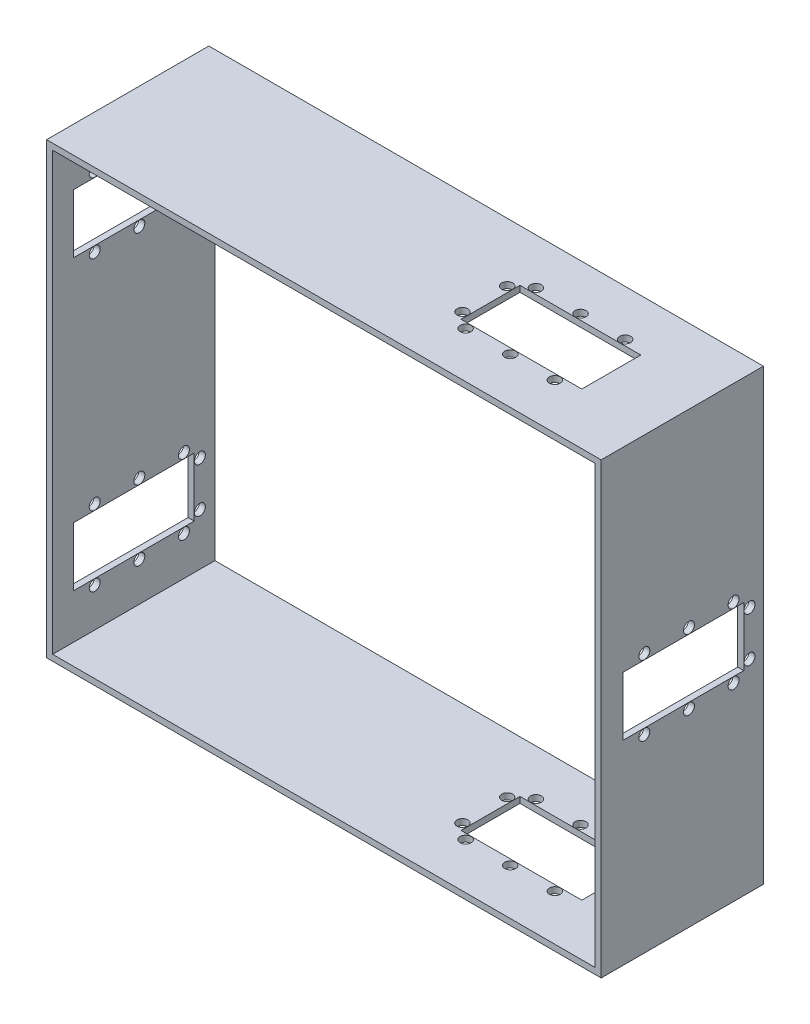
from build123d import *

# Parameters (mm, degrees)
ESBO_O2_W                  = 273.42
ESBO_O2_H                  = 221.24
RESSALTO_EXTRUS_O1_DEPTH   = 80
ESBO_O3_W                  = 267.42
ESBO_O3_H                  = 215.24
CORTE_EXTRUS_O1_DEPTH      = 80
ESBO_O4_W                  = 59.55
ESBO_O4_H                  = 29.05
CORTE_EXTRUS_O3_DEPTH      = 194.200436076
ESBO_O5_W                  = 59.55
ESBO_O5_H                  = 29.05
CORTE_EXTRUS_O4_DEPTH      = 194.200436076
CORTE_EXTRUS_O5_DEPTH      = 194.200436076
CORTE_EXTRUS_O5_DEPTH_BACK = 194.200436076
ESBO_O6_W                  = 59.55
ESBO_O6_H                  = 29.05
CORTE_EXTRUS_O6_DEPTH      = 194.200436076
CORTE_EXTRUS_O6_DEPTH_BACK = 194.200436076
ESBO_O7_R                  = 2.7
ESBO_O8_R                  = 2.7
CORTE_EXTRUS_O7_DEPTH      = 194.200436076
ESBO_O9_R                  = 2.7
CORTE_EXTRUS_O8_DEPTH      = 194.200436076


with BuildPart() as part:
    # Esboço2 → Ressalto-extrusão1 (new body)
    with BuildSketch(Plane.XY):
        Rectangle(ESBO_O2_W, ESBO_O2_H)
    extrude(amount=RESSALTO_EXTRUS_O1_DEPTH)

    # Esboço3 → Corte-extrusão1 (cut)
    with BuildSketch(Plane.XY):
        Rectangle(ESBO_O3_W, ESBO_O3_H)
    extrude(amount=CORTE_EXTRUS_O1_DEPTH, mode=Mode.SUBTRACT)

    # Esboço4 → Corte-extrusão3 (cut, through all)
    with BuildSketch(Plane(origin=(0, 0, 0), x_dir=(0, 0, -1), z_dir=(1, 0, 0))):
        with Locations((-39.439615286, 0)):
            Rectangle(ESBO_O4_W, ESBO_O4_H)
    extrude(amount=CORTE_EXTRUS_O3_DEPTH, mode=Mode.SUBTRACT)

    # Esboço5 → Corte-extrusão4 (cut, through all)
    with BuildSketch(Plane(origin=(0, 0, 0), x_dir=(0, 0, -1), z_dir=(1, 0, 0))):
        with Locations((-40, 71.095)):
            Rectangle(ESBO_O5_W, ESBO_O5_H)
        with Locations((-40, -71.095)):
            Rectangle(ESBO_O5_W, ESBO_O5_H)
    extrude(amount=-CORTE_EXTRUS_O4_DEPTH, mode=Mode.SUBTRACT)

    # Esboço6 → Corte-extrusão5 (cut, two sides: drawn at the far end of the back side and taken through both)
    with BuildSketch(Plane(origin=(0, 0, 0), x_dir=(1, 0, 0), z_dir=(0, 1, 0)).offset(-CORTE_EXTRUS_O5_DEPTH_BACK)):
        with Locations((71.935, -40)):
            Rectangle(ESBO_O6_W, ESBO_O6_H)
    extrude(amount=CORTE_EXTRUS_O5_DEPTH + CORTE_EXTRUS_O5_DEPTH_BACK, mode=Mode.SUBTRACT)

    # Esboço7 → Corte-extrusão6 (cut, two sides: drawn at the far end of the back side and taken through both)
    with BuildSketch(Plane(origin=(0, 0, 0), x_dir=(1, 0, 0), z_dir=(0, 1, 0)).offset(-CORTE_EXTRUS_O6_DEPTH_BACK)):
        with Locations(Location((91.21, -22.675, 0), (0, 0, 270))):
            Circle(ESBO_O7_R)
        with Locations(Location((69.21, -22.675, 0), (0, 0, 270))):
            Circle(ESBO_O7_R)
        with Locations(Location((47.21, -22.675, 0), (0, 0, 270))):
            Circle(ESBO_O7_R)
        with Locations(Location((91.21, -57.325, 0), (0, 0, 270))):
            Circle(ESBO_O7_R)
        with Locations(Location((69.21, -57.325, 0), (0, 0, 270))):
            Circle(ESBO_O7_R)
        with Locations(Location((47.21, -57.325, 0), (0, 0, 270))):
            Circle(ESBO_O7_R)
        with Locations(Location((39.36, -28.975, 0), (0, 0, 270))):
            Circle(ESBO_O7_R)
        with Locations(Location((39.36, -51.025, 0), (0, 0, 270))):
            Circle(ESBO_O7_R)
    extrude(amount=CORTE_EXTRUS_O6_DEPTH + CORTE_EXTRUS_O6_DEPTH_BACK, mode=Mode.SUBTRACT)

    # Esboço8 → Corte-extrusão7 (cut, through all)
    with BuildSketch(Plane(origin=(0, 0, 0), x_dir=(0, 0, -1), z_dir=(1, 0, 0))):
        with Locations((-59.275, -88.42)):
            Circle(ESBO_O8_R)
        with Locations((-37.275, -88.42)):
            Circle(ESBO_O8_R)
        with Locations((-15.275, -88.42)):
            Circle(ESBO_O8_R)
        with Locations((-15.275, -53.77)):
            Circle(ESBO_O8_R)
        with Locations((-37.275, -53.77)):
            Circle(ESBO_O8_R)
        with Locations((-59.275, -53.77)):
            Circle(ESBO_O8_R)
        with Locations((-7.425, -82.12)):
            Circle(ESBO_O8_R)
        with Locations((-7.425, -60.07)):
            Circle(ESBO_O8_R)
        with Locations((-59.275, 53.77)):
            Circle(ESBO_O8_R)
        with Locations((-37.275, 53.77)):
            Circle(ESBO_O8_R)
        with Locations((-15.275, 53.77)):
            Circle(ESBO_O8_R)
        with Locations((-7.425, 60.07)):
            Circle(ESBO_O8_R)
        with Locations((-7.425, 82.12)):
            Circle(ESBO_O8_R)
        with Locations((-15.275, 88.42)):
            Circle(ESBO_O8_R)
        with Locations((-37.275, 88.42)):
            Circle(ESBO_O8_R)
        with Locations((-59.275, 88.42)):
            Circle(ESBO_O8_R)
    extrude(amount=-CORTE_EXTRUS_O7_DEPTH, mode=Mode.SUBTRACT)

    # Esboço9 → Corte-extrusão8 (cut, through all)
    with BuildSketch(Plane(origin=(0, 0, 0), x_dir=(0, 0, -1), z_dir=(1, 0, 0))):
        with Locations(Location((-58.714615286, 17.325, 0), (0, 0, 180))):
            Circle(ESBO_O9_R)
        with Locations(Location((-36.714615286, 17.325, 0), (0, 0, 180))):
            Circle(ESBO_O9_R)
        with Locations(Location((-14.714615286, 17.325, 0), (0, 0, 180))):
            Circle(ESBO_O9_R)
        with Locations(Location((-14.714615286, -17.325, 0), (0, 0, 180))):
            Circle(ESBO_O9_R)
        with Locations(Location((-36.714615286, -17.325, 0), (0, 0, 180))):
            Circle(ESBO_O9_R)
        with Locations(Location((-58.714615286, -17.325, 0), (0, 0, 180))):
            Circle(ESBO_O9_R)
        with Locations(Location((-6.864615286, 11.025, 0), (0, 0, 180))):
            Circle(ESBO_O9_R)
        with Locations(Location((-6.864615286, -11.025, 0), (0, 0, 180))):
            Circle(ESBO_O9_R)
    extrude(amount=CORTE_EXTRUS_O8_DEPTH, mode=Mode.SUBTRACT)


solid = part.part
